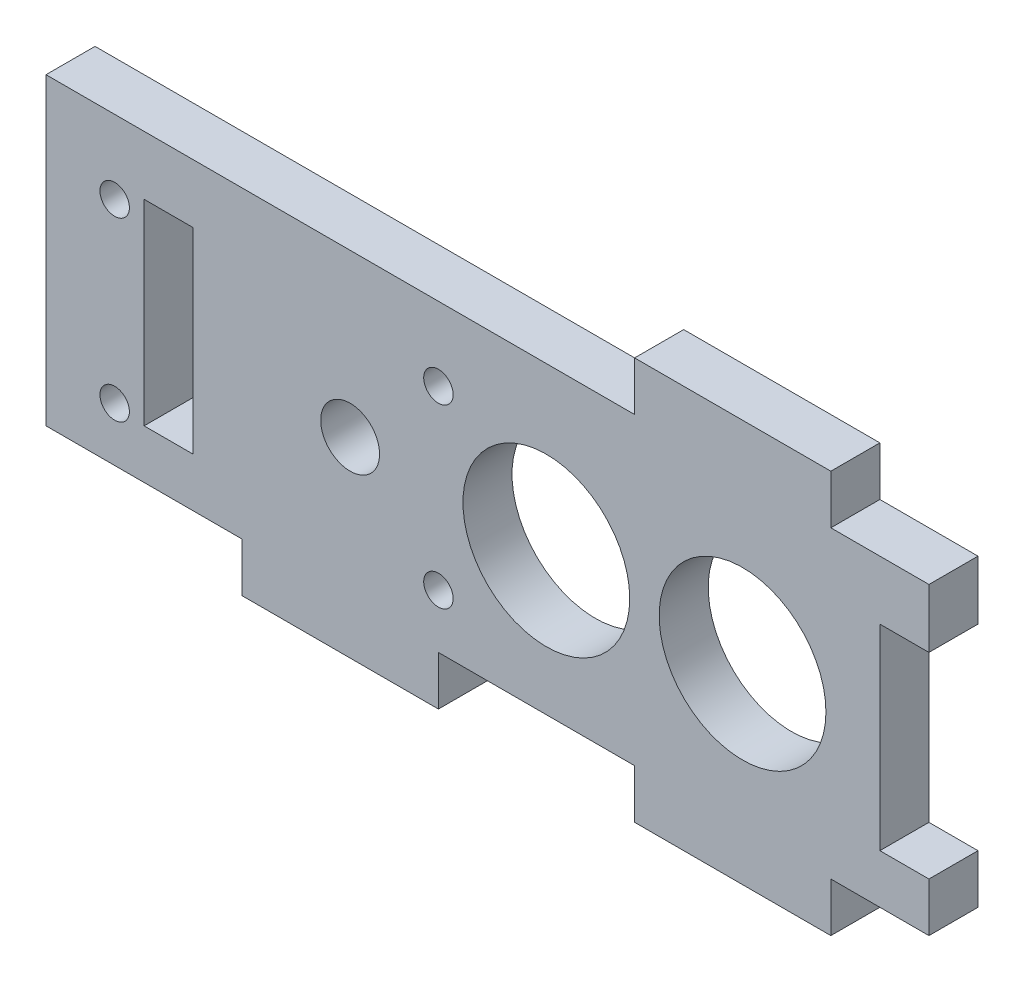
from build123d import *

# Parameters (mm, degrees)
SKETCH2_R           = 3
SKETCH2_R_2         = 8.5
SKETCH2_R_3         = 1.5
BOSS_EXTRUDE1_DEPTH = 5
SKETCH3_W           = 5
SKETCH3_H           = 31
BOSS_EXTRUDE2_DEPTH = 10
SKETCH4_R           = 1.5
SKETCH4_W           = 5
SKETCH4_H           = 20
CUT_EXTRUDE1_DEPTH  = 10


with BuildPart() as part:
    # Sketch2 → Boss-Extrude1 (new body)
    with BuildSketch(Plane.XY):
        Polygon((0, 0), (10, 0), (10, -5), (30, -5), (30, 0), (50, 0), (50, -5), (70, -5), (70, 0), (80, 0), (80, 5), (75, 5), (75, 23), (75, 25), (80, 25), (80, 31), (70, 31), (70, 36), (50, 36), (50, 31), (0, 31), align=None)
        with Locations((21, 14.5)):
            Circle(SKETCH2_R, mode=Mode.SUBTRACT)
        with Locations((41, 14.5)):
            Circle(SKETCH2_R_2, mode=Mode.SUBTRACT)
        with Locations((61, 14.5)):
            Circle(SKETCH2_R_2, mode=Mode.SUBTRACT)
        with Locations((30, 23.5)):
            Circle(SKETCH2_R_3, mode=Mode.SUBTRACT)
        with Locations((30, 5.5)):
            Circle(SKETCH2_R_3, mode=Mode.SUBTRACT)
    extrude(amount=-BOSS_EXTRUDE1_DEPTH)

    # Sketch3 → Boss-Extrude2 (add)
    with BuildSketch(Plane.ZY):
        with Locations((-2.5, 15.5)):
            Rectangle(SKETCH3_W, SKETCH3_H)
    extrude(amount=BOSS_EXTRUDE2_DEPTH)

    # Sketch4 → Cut-Extrude1 (cut)
    with BuildSketch(Plane.XY):
        with Locations((-3, 23.5)):
            Circle(SKETCH4_R)
        with Locations((-3, 5.5)):
            Circle(SKETCH4_R)
        with Locations((2.5, 15)):
            Rectangle(SKETCH4_W, SKETCH4_H)
    extrude(amount=-CUT_EXTRUDE1_DEPTH, mode=Mode.SUBTRACT)


solid = part.part
